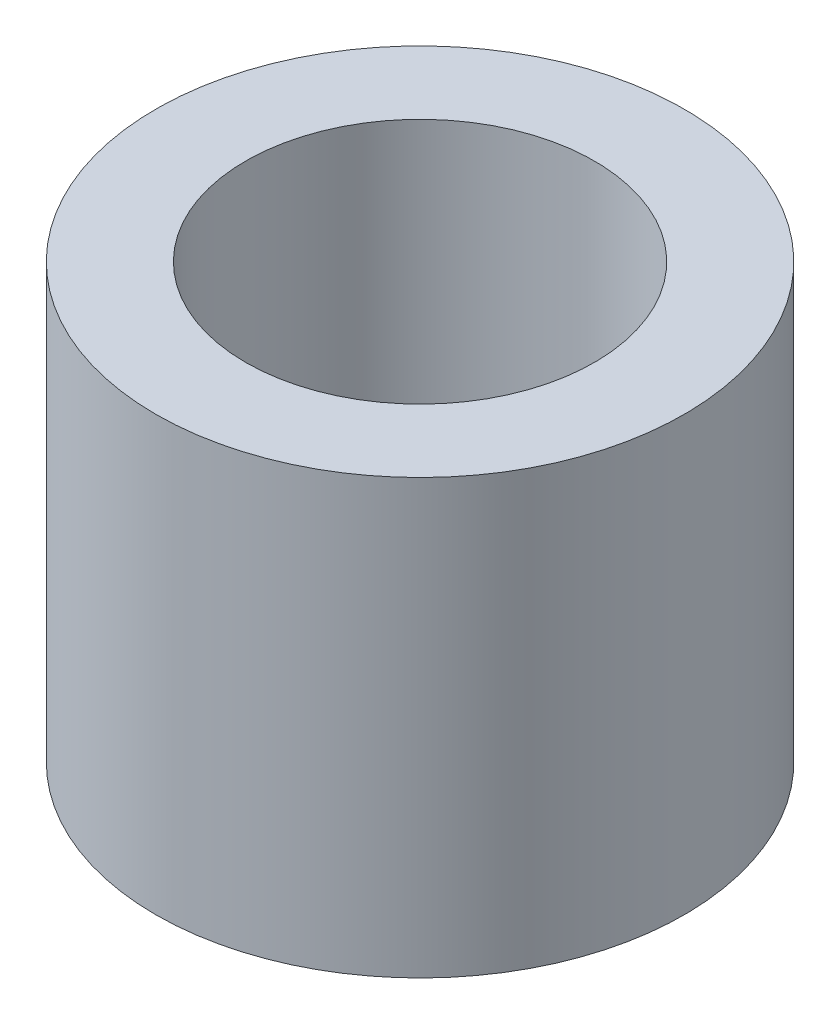
from build123d import *

# Parameters (mm, degrees)
SKETCH_1_R      = 2.5
SKETCH_1_R_2    = 1.65
EXTRUDE_1_DEPTH = 4.1


with BuildPart() as part:
    # 草图1 → 凸台-拉伸1 (new body)
    with BuildSketch(Plane(origin=(0, 0, 0), x_dir=(1, 0, 0), z_dir=(0, 1, 0))):
        with Locations(Location((0, 0, 0), (0, 0, 270))):
            Circle(SKETCH_1_R)
        with Locations(Location((0, 0, 0), (0, 0, 270))):
            Circle(SKETCH_1_R_2, mode=Mode.SUBTRACT)
    extrude(amount=EXTRUDE_1_DEPTH)


solid = part.part
